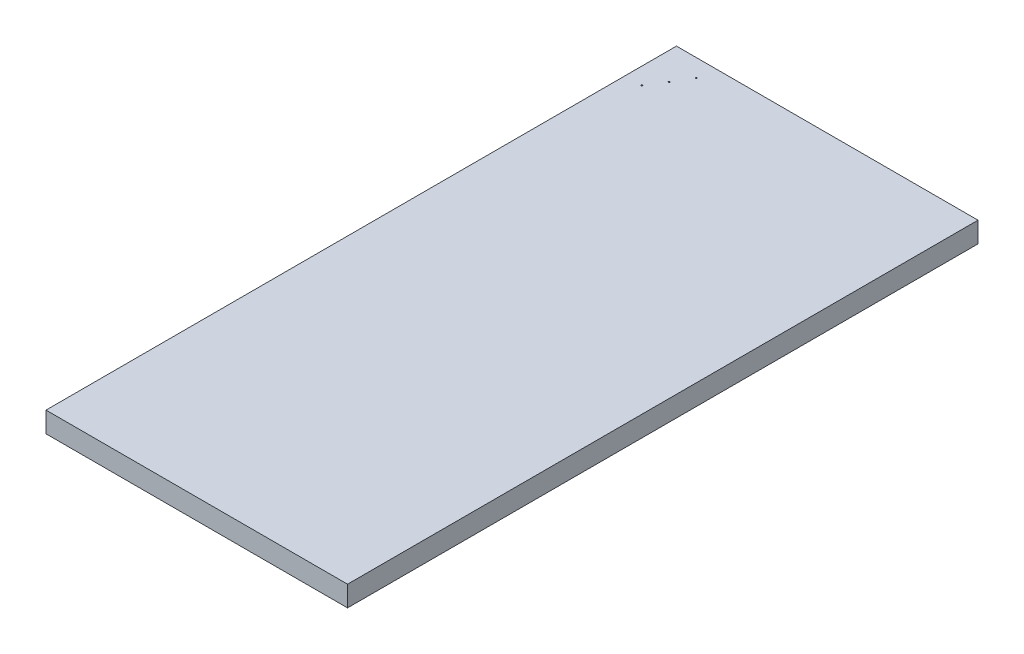
from build123d import *

# Parameters (mm, degrees)
SKETCH1_W               = 279.4
SKETCH1_H               = 584.2
BOSS_EXTRUDE1_DEPTH     = 19.05
CUT_EXTRUDE1_DEPTH      = 475.506199549
CUT_EXTRUDE1_DEPTH_BACK = 475.506199549
SKETCH2_R               = 0.635


with BuildPart() as part:
    # Sketch1 → Boss-Extrude1 (new body)
    with BuildSketch(Plane(origin=(0, 0, 0), x_dir=(1, 0, 0), z_dir=(0, 1, 0))):
        with Locations((0.412094395, -160.847935103)):
            Rectangle(SKETCH1_W, SKETCH1_H)
    extrude(amount=BOSS_EXTRUDE1_DEPTH)

    # Sketch2 → Cut-Extrude1 (cut, two sides: drawn at the far end of the back side and taken through both)
    with BuildSketch(Plane(origin=(0, 19.05, 0), x_dir=(1, 0, 0), z_dir=(0, 1, 0)).offset(-CUT_EXTRUDE1_DEPTH_BACK)):
        with Locations(Location((-113.922633314, 99.053998407, 0), (0, 0, 270))):
            Circle(SKETCH2_R)
        with Locations(Location((-104.416850901, 114.677411757, 0), (0, 0, 270))):
            Circle(SKETCH2_R)
        with Locations(Location((-123.887731018, 83.719469664, 0), (0, 0, 270))):
            Circle(SKETCH2_R)
    extrude(amount=CUT_EXTRUDE1_DEPTH + CUT_EXTRUDE1_DEPTH_BACK, mode=Mode.SUBTRACT)


solid = part.part
